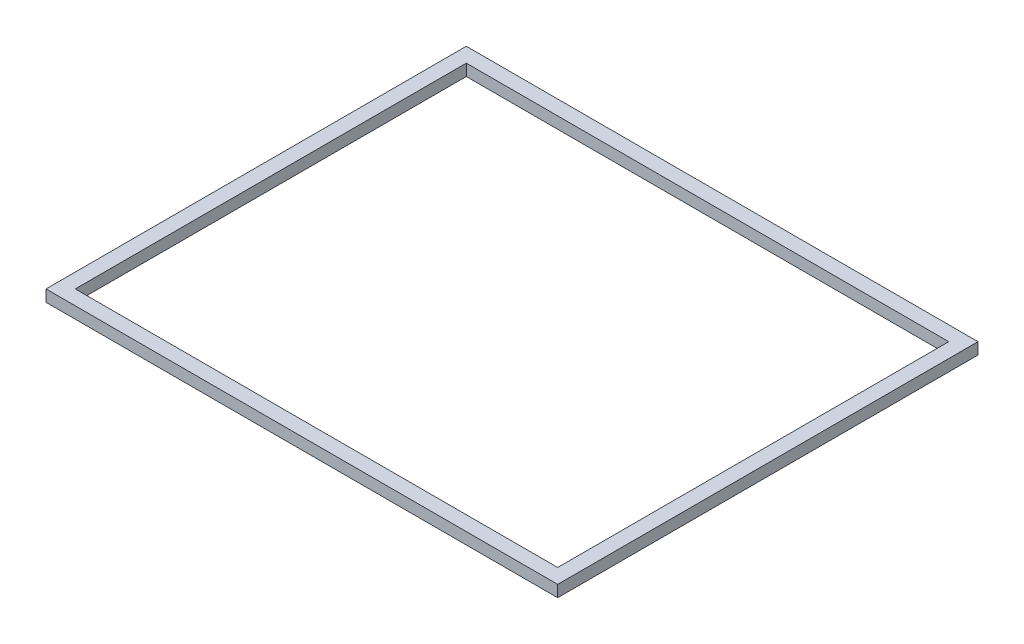
from build123d import *

# Parameters (mm, degrees)
SKETCH1_W           = 280
SKETCH1_H           = 230
SKETCH1_W_2         = 264
SKETCH1_H_2         = 214
BOSS_EXTRUDE1_DEPTH = 6.35


with BuildPart() as part:
    # Sketch1 → Boss-Extrude1 (new body)
    with BuildSketch(Plane(origin=(0, 0, 0), x_dir=(1, 0, 0), z_dir=(0, 1, 0))):
        with Locations((140, 115)):
            Rectangle(SKETCH1_W, SKETCH1_H)
        with Locations((140, 115)):
            Rectangle(SKETCH1_W_2, SKETCH1_H_2, mode=Mode.SUBTRACT)
    extrude(amount=BOSS_EXTRUDE1_DEPTH)


solid = part.part
